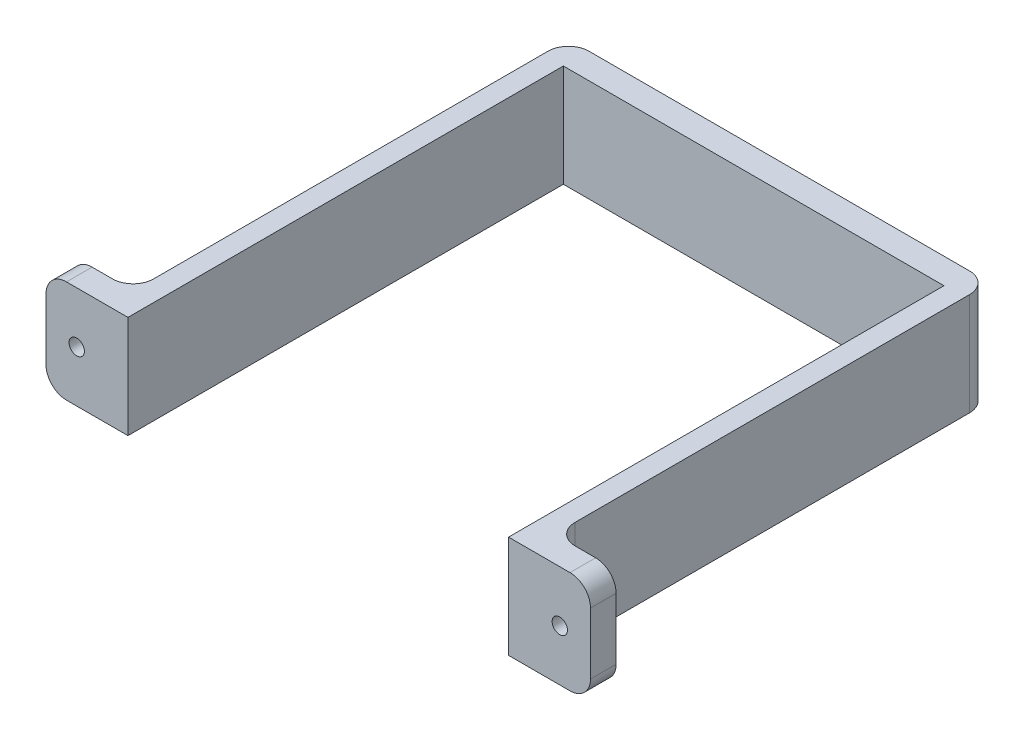
from build123d import *

# Parameters (mm, degrees)
SCHIZZO1_W                     = 74.3
SCHIZZO1_H                     = 20
ESTRUSIONE_ESTRUSIONE1_DEPTH   = 5
SCHIZZO2_W                     = 4
SCHIZZO2_H                     = 20
ESTRUSIONE_ESTRUSIONE2_DEPTH   = 85
ESTRUSIONE_ESTRUSIONE2_2_DEPTH = 85
SCHIZZO3_W                     = 4
SCHIZZO3_H                     = 20
ESTRUSIONE_ESTRUSIONE3_DEPTH   = 5
SCHIZZO4_W                     = 5
SCHIZZO4_H                     = 20
ESTRUSIONE_ESTRUSIONE4_DEPTH   = 12
SCHIZZO5_R                     = 1.5
TAGLIO_ESTRUSIONE1_DEPTH       = 101.746823771
SCHIZZO6_W                     = 5
SCHIZZO6_H                     = 20
ESTRUSIONE_ESTRUSIONE5_DEPTH   = 12
RACCORDO1_R                    = 4


with BuildPart() as part:
    # Schizzo1 → Estrusione-Estrusione1 (new body)
    with BuildSketch(Plane.XY):
        Rectangle(SCHIZZO1_W, SCHIZZO1_H)
    extrude(amount=ESTRUSIONE_ESTRUSIONE1_DEPTH)



with BuildPart() as body_2:
    # Schizzo2 → Estrusione-Estrusione2 (new body)
    with BuildSketch(Plane.XY.offset(5)):
        with Locations((-39.15, 0)):
            Rectangle(SCHIZZO2_W, SCHIZZO2_H)
    extrude(amount=ESTRUSIONE_ESTRUSIONE2_DEPTH)


with BuildPart() as body_3:
    # Schizzo2 → Estrusione-Estrusione2 2 (new body)
    with BuildSketch(Plane.XY.offset(5)):
        with Locations((39.15, 0)):
            Rectangle(SCHIZZO2_W, SCHIZZO2_H)
    extrude(amount=ESTRUSIONE_ESTRUSIONE2_2_DEPTH)


with BuildPart() as part_1:
    add(part.part)

    add(body_2.part)  # Estrusione-Estrusione3 merges body 2

    add(body_3.part)  # Estrusione-Estrusione3 merges body 3
    # Schizzo3 → Estrusione-Estrusione3 (add)
    with BuildSketch(Plane(origin=(0, 0, 5), x_dir=(-1, 0, 0), z_dir=(0, 0, -1))):
        with Locations((-39.15, 0)):
            Rectangle(SCHIZZO3_W, SCHIZZO3_H)
        with Locations((39.15, 0)):
            Rectangle(SCHIZZO3_W, SCHIZZO3_H)
    extrude(amount=ESTRUSIONE_ESTRUSIONE3_DEPTH)

    # Schizzo4 → Estrusione-Estrusione4 (add)
    with BuildSketch(Plane(origin=(41.15, 0, 0), x_dir=(0, 0, -1), z_dir=(1, 0, 0))):
        with Locations((-87.5, 0)):
            Rectangle(SCHIZZO4_W, SCHIZZO4_H)
    extrude(amount=ESTRUSIONE_ESTRUSIONE4_DEPTH)

    # Schizzo5 → Taglio-Estrusione1 (cut, through all)
    with BuildSketch(Plane(origin=(0, 0, 85), x_dir=(-1, 0, 0), z_dir=(0, 0, -1))):
        with Locations((-47.15, 0)):
            Circle(SCHIZZO5_R)
    taglio_estrusione1 = extrude(amount=-TAGLIO_ESTRUSIONE1_DEPTH, mode=Mode.SUBTRACT)

    # Schizzo6 → Estrusione-Estrusione5 (add)
    with BuildSketch(Plane.ZY.offset(41.15)):
        with Locations((87.5, 0)):
            Rectangle(SCHIZZO6_W, SCHIZZO6_H)
    extrude(amount=ESTRUSIONE_ESTRUSIONE5_DEPTH)

    # Specchia13: Taglio-Estrusione1 across plane
    add(taglio_estrusione1.mirror(Plane(origin=(0, 0, 0), x_dir=(0, 0, 1), z_dir=(1, 0, 0))), mode=Mode.SUBTRACT)

    # Raccordo1
    raccordo1_edges = [part_1.edges().sort_by_distance(p)[0] for p in [
        (-41.15, 0, 85),
        (-53.15, 10, 87.5),
        (-53.15, -10, 87.5),
        (41.15, 0, 0),
        (-41.15, 0, 0),
        (41.15, 0, 85),
        (53.15, -10, 87.5),
        (53.15, 10, 87.5),
    ]]
    fillet(raccordo1_edges, radius=RACCORDO1_R)


solid = part_1.part
